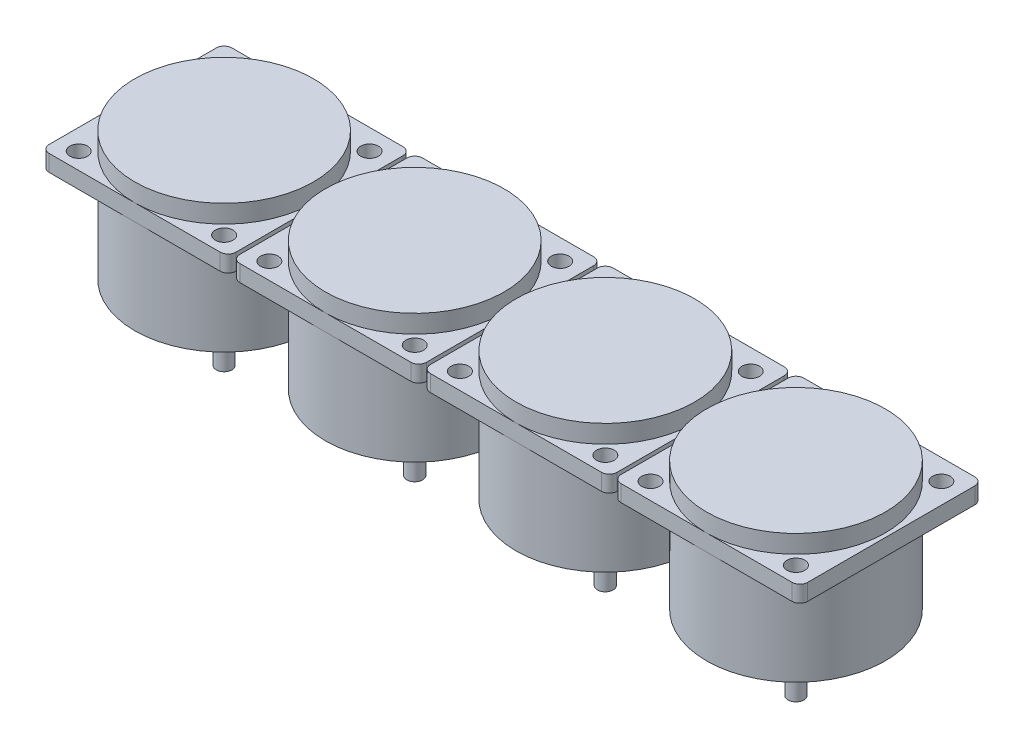
from build123d import *

# Parameters (mm, degrees)
DIAL_FACE_R            = 22.75
BOSS_EXTRUDE11_DEPTH   = 8.8
BOSS_EXTRUDE11_2_DEPTH = 8.8
BOSS_EXTRUDE11_3_DEPTH = 8.8
BOSS_EXTRUDE11_4_DEPTH = 8.8
BOSS_EXTRUDE12_DEPTH   = 4.2
CUT_EXTRUDE9_REACH     = 173.135
DIAL_FACE_17_R         = 2.25
BOSS_EXTRUDE13_START   = -24
DIAL_FACE_19_R         = 22.75
BOSS_EXTRUDE13_DEPTH   = 24
DIAL_FACE_21_R         = 2
DIAL_FACE_21_R_2       = 2.001751506
BOSS_EXTRUDE14_DEPTH   = 33


with BuildPart() as part:
    # Dial Face → Boss-Extrude11 (new body)
    with BuildSketch(Plane(origin=(0, 0, 0), x_dir=(1, 0, 0), z_dir=(0, 1, 0))):
        Circle(DIAL_FACE_R)
    extrude(amount=BOSS_EXTRUDE11_DEPTH)



with BuildPart() as body_2:
    # Dial Face → Boss-Extrude11 2 (new body)
    with BuildSketch(Plane(origin=(0, 0, 0), x_dir=(1, 0, 0), z_dir=(0, 1, 0))):
        with Locations((48.5, 0)):
            Circle(DIAL_FACE_R)
    extrude(amount=BOSS_EXTRUDE11_2_DEPTH)


with BuildPart() as body_3:
    # Dial Face → Boss-Extrude11 3 (new body)
    with BuildSketch(Plane(origin=(0, 0, 0), x_dir=(1, 0, 0), z_dir=(0, 1, 0))):
        with Locations((97, 0)):
            Circle(DIAL_FACE_R)
    extrude(amount=BOSS_EXTRUDE11_3_DEPTH)


with BuildPart() as body_4:
    # Dial Face → Boss-Extrude11 4 (new body)
    with BuildSketch(Plane(origin=(0, 0, 0), x_dir=(1, 0, 0), z_dir=(0, 1, 0))):
        with Locations((145.5, 0)):
            Circle(DIAL_FACE_R)
    extrude(amount=BOSS_EXTRUDE11_4_DEPTH)


with BuildPart() as part_1:
    add(part.part)

    add(body_2.part)  # Boss-Extrude12 merges body 2

    add(body_3.part)  # Boss-Extrude12 merges body 3

    add(body_4.part)  # Boss-Extrude12 merges body 4
    # Dial Face<16> → Boss-Extrude12 (add)
    with BuildSketch(Plane(origin=(0, 0, 0), x_dir=(1, 0, 0), z_dir=(0, 1, 0))):
        with BuildLine():
            Line((21.75, 23.75), (-21.75, 23.75))
            ThreePointArc((-21.75, 23.75), (-23.164213562, 23.164213562), (-23.75, 21.75))
            Line((-23.75, 21.75), (-23.75, -20.75))
            ThreePointArc((-23.75, -20.75), (-23.164213562, -22.164213562), (-21.75, -22.75))
            Line((-21.75, -22.75), (21.75, -22.75))
            ThreePointArc((21.75, -22.75), (23.164213562, -22.164213562), (23.75, -20.75))
            Line((23.75, -20.75), (23.75, 21.75))
            ThreePointArc((23.75, 21.75), (23.164213562, 23.164213562), (21.75, 23.75))
        make_face()
        with BuildLine():
            Line((24.75, 21.75), (24.75, -20.75))
            ThreePointArc((24.75, -20.75), (25.335786438, -22.164213562), (26.75, -22.75))
            Line((26.75, -22.75), (70.25, -22.75))
            ThreePointArc((70.25, -22.75), (71.664213562, -22.164213562), (72.25, -20.75))
            Line((72.25, -20.75), (72.25, 21.75))
            ThreePointArc((72.25, 21.75), (71.664213562, 23.164213562), (70.25, 23.75))
            Line((70.25, 23.75), (26.75, 23.75))
            ThreePointArc((26.75, 23.75), (25.335786438, 23.164213562), (24.75, 21.75))
        make_face()
        with BuildLine():
            Line((73.25, 21.75), (73.25, -20.75))
            ThreePointArc((73.25, -20.75), (73.835786438, -22.164213562), (75.25, -22.75))
            Line((75.25, -22.75), (118.75, -22.75))
            ThreePointArc((118.75, -22.75), (120.164213562, -22.164213562), (120.75, -20.75))
            Line((120.75, -20.75), (120.75, 21.75))
            ThreePointArc((120.75, 21.75), (120.164213562, 23.164213562), (118.75, 23.75))
            Line((118.75, 23.75), (75.25, 23.75))
            ThreePointArc((75.25, 23.75), (73.835786438, 23.164213562), (73.25, 21.75))
        make_face()
        with BuildLine():
            Line((121.75, 21.75), (121.75, -20.75))
            ThreePointArc((121.75, -20.75), (122.335786438, -22.164213562), (123.75, -22.75))
            Line((123.75, -22.75), (167.25, -22.75))
            ThreePointArc((167.25, -22.75), (168.664213562, -22.164213562), (169.25, -20.75))
            Line((169.25, -20.75), (169.25, 21.75))
            ThreePointArc((169.25, 21.75), (168.664213562, 23.164213562), (167.25, 23.75))
            Line((167.25, 23.75), (123.75, 23.75))
            ThreePointArc((123.75, 23.75), (122.335786438, 23.164213562), (121.75, 21.75))
        make_face()
    extrude(amount=BOSS_EXTRUDE12_DEPTH)

    # Dial Face<17> → Cut-Extrude9 (cut, up to next)
    with BuildSketch(Plane(origin=(0, 0, 0), x_dir=(1, 0, 0), z_dir=(0, 1, 0)), mode=Mode.PRIVATE) as cut_extrude9_sk1:
        with Locations((18.5, 18.5)):
            Circle(DIAL_FACE_17_R)
    cut_extrude9_tool1 = extrude(cut_extrude9_sk1.sketch, amount=CUT_EXTRUDE9_REACH, mode=Mode.PRIVATE) & part_1.part
    # Dial Face<17> → Cut-Extrude9 (cut, up to next)
    with BuildSketch(Plane(origin=(0, 0, 0), x_dir=(1, 0, 0), z_dir=(0, 1, 0)), mode=Mode.PRIVATE) as cut_extrude9_sk2:
        with Locations((18.5, -18.5)):
            Circle(DIAL_FACE_17_R)
    cut_extrude9_tool2 = extrude(cut_extrude9_sk2.sketch, amount=CUT_EXTRUDE9_REACH, mode=Mode.PRIVATE) & part_1.part
    # Dial Face<17> → Cut-Extrude9 (cut, up to next)
    with BuildSketch(Plane(origin=(0, 0, 0), x_dir=(1, 0, 0), z_dir=(0, 1, 0)), mode=Mode.PRIVATE) as cut_extrude9_sk3:
        with Locations((-18.5, 18.5)):
            Circle(DIAL_FACE_17_R)
    cut_extrude9_tool3 = extrude(cut_extrude9_sk3.sketch, amount=CUT_EXTRUDE9_REACH, mode=Mode.PRIVATE) & part_1.part
    # Dial Face<17> → Cut-Extrude9 (cut, up to next)
    with BuildSketch(Plane(origin=(0, 0, 0), x_dir=(1, 0, 0), z_dir=(0, 1, 0)), mode=Mode.PRIVATE) as cut_extrude9_sk4:
        with Locations((-18.5, -18.5)):
            Circle(DIAL_FACE_17_R)
    cut_extrude9_tool4 = extrude(cut_extrude9_sk4.sketch, amount=CUT_EXTRUDE9_REACH, mode=Mode.PRIVATE) & part_1.part
    # Dial Face<17> → Cut-Extrude9 (cut, up to next)
    with BuildSketch(Plane(origin=(0, 0, 0), x_dir=(1, 0, 0), z_dir=(0, 1, 0)), mode=Mode.PRIVATE) as cut_extrude9_sk5:
        with Locations((67, -18.5)):
            Circle(DIAL_FACE_17_R)
    cut_extrude9_tool5 = extrude(cut_extrude9_sk5.sketch, amount=CUT_EXTRUDE9_REACH, mode=Mode.PRIVATE) & part_1.part
    # Dial Face<17> → Cut-Extrude9 (cut, up to next)
    with BuildSketch(Plane(origin=(0, 0, 0), x_dir=(1, 0, 0), z_dir=(0, 1, 0)), mode=Mode.PRIVATE) as cut_extrude9_sk6:
        with Locations((67, 18.5)):
            Circle(DIAL_FACE_17_R)
    cut_extrude9_tool6 = extrude(cut_extrude9_sk6.sketch, amount=CUT_EXTRUDE9_REACH, mode=Mode.PRIVATE) & part_1.part
    # Dial Face<17> → Cut-Extrude9 (cut, up to next)
    with BuildSketch(Plane(origin=(0, 0, 0), x_dir=(1, 0, 0), z_dir=(0, 1, 0)), mode=Mode.PRIVATE) as cut_extrude9_sk7:
        with Locations((30, 18.5)):
            Circle(DIAL_FACE_17_R)
    cut_extrude9_tool7 = extrude(cut_extrude9_sk7.sketch, amount=CUT_EXTRUDE9_REACH, mode=Mode.PRIVATE) & part_1.part
    # Dial Face<17> → Cut-Extrude9 (cut, up to next)
    with BuildSketch(Plane(origin=(0, 0, 0), x_dir=(1, 0, 0), z_dir=(0, 1, 0)), mode=Mode.PRIVATE) as cut_extrude9_sk8:
        with Locations((30, -18.5)):
            Circle(DIAL_FACE_17_R)
    cut_extrude9_tool8 = extrude(cut_extrude9_sk8.sketch, amount=CUT_EXTRUDE9_REACH, mode=Mode.PRIVATE) & part_1.part
    # Dial Face<17> → Cut-Extrude9 (cut, up to next)
    with BuildSketch(Plane(origin=(0, 0, 0), x_dir=(1, 0, 0), z_dir=(0, 1, 0)), mode=Mode.PRIVATE) as cut_extrude9_sk9:
        with Locations((115.5, -18.5)):
            Circle(DIAL_FACE_17_R)
    cut_extrude9_tool9 = extrude(cut_extrude9_sk9.sketch, amount=CUT_EXTRUDE9_REACH, mode=Mode.PRIVATE) & part_1.part
    # Dial Face<17> → Cut-Extrude9 (cut, up to next)
    with BuildSketch(Plane(origin=(0, 0, 0), x_dir=(1, 0, 0), z_dir=(0, 1, 0)), mode=Mode.PRIVATE) as cut_extrude9_sk10:
        with Locations((115.5, 18.5)):
            Circle(DIAL_FACE_17_R)
    cut_extrude9_tool10 = extrude(cut_extrude9_sk10.sketch, amount=CUT_EXTRUDE9_REACH, mode=Mode.PRIVATE) & part_1.part
    # Dial Face<17> → Cut-Extrude9 (cut, up to next)
    with BuildSketch(Plane(origin=(0, 0, 0), x_dir=(1, 0, 0), z_dir=(0, 1, 0)), mode=Mode.PRIVATE) as cut_extrude9_sk11:
        with Locations((78.5, 18.5)):
            Circle(DIAL_FACE_17_R)
    cut_extrude9_tool11 = extrude(cut_extrude9_sk11.sketch, amount=CUT_EXTRUDE9_REACH, mode=Mode.PRIVATE) & part_1.part
    # Dial Face<17> → Cut-Extrude9 (cut, up to next)
    with BuildSketch(Plane(origin=(0, 0, 0), x_dir=(1, 0, 0), z_dir=(0, 1, 0)), mode=Mode.PRIVATE) as cut_extrude9_sk12:
        with Locations((78.5, -18.5)):
            Circle(DIAL_FACE_17_R)
    cut_extrude9_tool12 = extrude(cut_extrude9_sk12.sketch, amount=CUT_EXTRUDE9_REACH, mode=Mode.PRIVATE) & part_1.part
    # Dial Face<17> → Cut-Extrude9 (cut, up to next)
    with BuildSketch(Plane(origin=(0, 0, 0), x_dir=(1, 0, 0), z_dir=(0, 1, 0)), mode=Mode.PRIVATE) as cut_extrude9_sk13:
        with Locations((164, -18.5)):
            Circle(DIAL_FACE_17_R)
    cut_extrude9_tool13 = extrude(cut_extrude9_sk13.sketch, amount=CUT_EXTRUDE9_REACH, mode=Mode.PRIVATE) & part_1.part
    # Dial Face<17> → Cut-Extrude9 (cut, up to next)
    with BuildSketch(Plane(origin=(0, 0, 0), x_dir=(1, 0, 0), z_dir=(0, 1, 0)), mode=Mode.PRIVATE) as cut_extrude9_sk14:
        with Locations((164, 18.5)):
            Circle(DIAL_FACE_17_R)
    cut_extrude9_tool14 = extrude(cut_extrude9_sk14.sketch, amount=CUT_EXTRUDE9_REACH, mode=Mode.PRIVATE) & part_1.part
    # Dial Face<17> → Cut-Extrude9 (cut, up to next)
    with BuildSketch(Plane(origin=(0, 0, 0), x_dir=(1, 0, 0), z_dir=(0, 1, 0)), mode=Mode.PRIVATE) as cut_extrude9_sk15:
        with Locations((127, 18.5)):
            Circle(DIAL_FACE_17_R)
    cut_extrude9_tool15 = extrude(cut_extrude9_sk15.sketch, amount=CUT_EXTRUDE9_REACH, mode=Mode.PRIVATE) & part_1.part
    # Dial Face<17> → Cut-Extrude9 (cut, up to next)
    with BuildSketch(Plane(origin=(0, 0, 0), x_dir=(1, 0, 0), z_dir=(0, 1, 0)), mode=Mode.PRIVATE) as cut_extrude9_sk16:
        with Locations((127, -18.5)):
            Circle(DIAL_FACE_17_R)
    cut_extrude9_tool16 = extrude(cut_extrude9_sk16.sketch, amount=CUT_EXTRUDE9_REACH, mode=Mode.PRIVATE) & part_1.part
    add(cut_extrude9_tool1.solids().sort_by_distance((18.5, 0, -18.5))[0], mode=Mode.SUBTRACT)
    add(cut_extrude9_tool2.solids().sort_by_distance((18.5, 0, 18.5))[0], mode=Mode.SUBTRACT)
    add(cut_extrude9_tool3.solids().sort_by_distance((-18.5, 0, -18.5))[0], mode=Mode.SUBTRACT)
    add(cut_extrude9_tool4.solids().sort_by_distance((-18.5, 0, 18.5))[0], mode=Mode.SUBTRACT)
    add(cut_extrude9_tool5.solids().sort_by_distance((67, 0, 18.5))[0], mode=Mode.SUBTRACT)
    add(cut_extrude9_tool6.solids().sort_by_distance((67, 0, -18.5))[0], mode=Mode.SUBTRACT)
    add(cut_extrude9_tool7.solids().sort_by_distance((30, 0, -18.5))[0], mode=Mode.SUBTRACT)
    add(cut_extrude9_tool8.solids().sort_by_distance((30, 0, 18.5))[0], mode=Mode.SUBTRACT)
    add(cut_extrude9_tool9.solids().sort_by_distance((115.5, 0, 18.5))[0], mode=Mode.SUBTRACT)
    add(cut_extrude9_tool10.solids().sort_by_distance((115.5, 0, -18.5))[0], mode=Mode.SUBTRACT)
    add(cut_extrude9_tool11.solids().sort_by_distance((78.5, 0, -18.5))[0], mode=Mode.SUBTRACT)
    add(cut_extrude9_tool12.solids().sort_by_distance((78.5, 0, 18.5))[0], mode=Mode.SUBTRACT)
    add(cut_extrude9_tool13.solids().sort_by_distance((164, 0, 18.5))[0], mode=Mode.SUBTRACT)
    add(cut_extrude9_tool14.solids().sort_by_distance((164, 0, -18.5))[0], mode=Mode.SUBTRACT)
    add(cut_extrude9_tool15.solids().sort_by_distance((127, 0, -18.5))[0], mode=Mode.SUBTRACT)
    add(cut_extrude9_tool16.solids().sort_by_distance((127, 0, 18.5))[0], mode=Mode.SUBTRACT)

    # Dial Face<19> → Boss-Extrude13 (add)
    with BuildSketch(Plane(origin=(0, 0, 0), x_dir=(1, 0, 0), z_dir=(0, 1, 0)).offset(BOSS_EXTRUDE13_START)):
        Circle(DIAL_FACE_19_R)
        with Locations((48.5, 0)):
            Circle(DIAL_FACE_19_R)
        with Locations((97, 0)):
            Circle(DIAL_FACE_19_R)
        with Locations((145.5, 0)):
            Circle(DIAL_FACE_19_R)
    extrude(amount=BOSS_EXTRUDE13_DEPTH)

    # Dial Face<21> → Boss-Extrude14 (add)
    with BuildSketch(Plane(origin=(0, 0, 0), x_dir=(1, 0, 0), z_dir=(0, 1, 0))):
        with Locations((-10, -10)):
            Circle(DIAL_FACE_21_R)
        with Locations((10, -10)):
            Circle(DIAL_FACE_21_R_2)
        with Locations((38.5, -10)):
            Circle(DIAL_FACE_21_R)
        with Locations((58.5, -10)):
            Circle(DIAL_FACE_21_R_2)
        with Locations((87, -10)):
            Circle(DIAL_FACE_21_R)
        with Locations((107, -10)):
            Circle(DIAL_FACE_21_R_2)
        with Locations((135.5, -10)):
            Circle(DIAL_FACE_21_R)
        with Locations((155.5, -10)):
            Circle(DIAL_FACE_21_R_2)
    extrude(amount=-BOSS_EXTRUDE14_DEPTH)


solid = part_1.part
